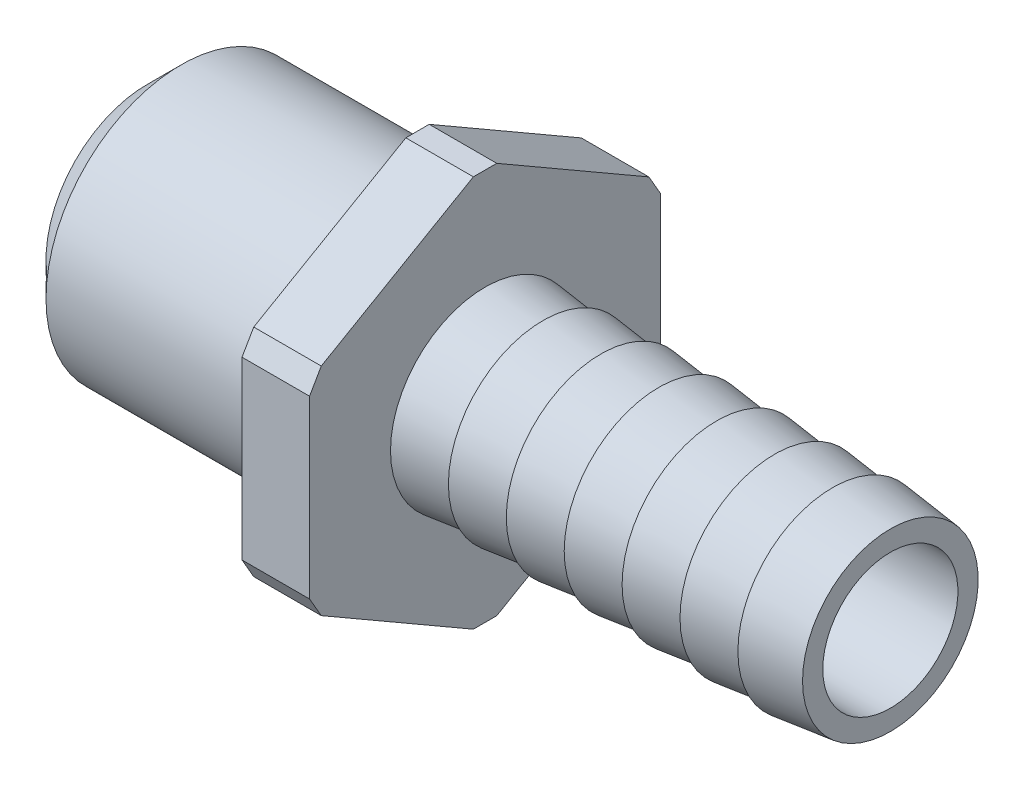
from build123d import *

# Parameters (mm, degrees)
CHAMFER1_SIZE      = 0.5
SKETCH2_R          = 6
CUT_EXTRUDE2_DEPTH = 9.185352772
CHAMFER2_SIZE      = 0.2


with BuildPart() as part:
    # Sketch1 → Revolve1 (revolve)
    with BuildSketch(Plane.XY, mode=Mode.PRIVATE) as revolve1_sk:
        Polygon((0, 1), (11, 1), (11, 1.3), (10.142857143, 1.4), (10.142857143, 1.3), (9.285714286, 1.4), (9.285714286, 1.3), (8.428571429, 1.4), (8.428571429, 1.3), (7.571428571, 1.4), (7.571428571, 1.3), (6.714285714, 1.4), (6.714285714, 1.3), (5.857142857, 1.4), (5.857142857, 1.3), (5, 1.4), (5, 3), (4, 3), (4, 2), (0, 2), align=None)
    revolve(revolve1_sk.sketch.rotate(Axis((0, 0, 0), (1, 0, 0)), 90), axis=Axis((0, 0, 0), (1, 0, 0)))

    # Chamfer1
    chamfer1_edges = [part.edges().sort_by_distance(p)[0] for p in [
        (0, 0, -2),
    ]]
    chamfer(chamfer1_edges, length=CHAMFER1_SIZE)

    # Sketch2 → Cut-Extrude2 (cut, through all)
    with BuildSketch(Plane.ZY.offset(-4)):
        Circle(SKETCH2_R)
        Polygon((0, 3), (-2.598076211, 1.5), (-2.598076211, -1.5), (0, -3), (2.598076211, -1.5), (2.598076211, 1.5), align=None, mode=Mode.SUBTRACT)
    extrude(amount=-CUT_EXTRUDE2_DEPTH, mode=Mode.SUBTRACT)

    # Chamfer2
    chamfer2_edges = [part.edges().sort_by_distance(p)[0] for p in [
        (4.5, 1.5, 2.598076211),
        (4.5, -1.5, 2.598076211),
        (4.5, -3, 0),
        (4.5, -1.5, -2.598076211),
        (4.5, 1.5, -2.598076211),
        (4.5, 3, 0),
    ]]
    chamfer(chamfer2_edges, length=CHAMFER2_SIZE)


solid = part.part
